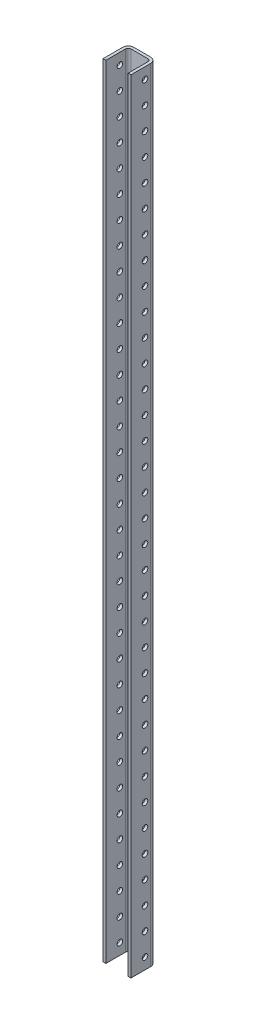
from build123d import *

# Parameters (mm, degrees)
EXTRUDE1_DEPTH = 444.5
SKETCH2_R      = 4.826
SKETCH2_R_2    = 1.5875
EXTRUDE2_DEPTH = 25
SKETCH3_R      = 3.175
EXTRUDE3_DEPTH = 35


with BuildPart() as part:
    # Sketch1 → Extrude1 (new, symmetric)
    with BuildSketch(Plane(origin=(0, 0, 0), x_dir=(1, 0, 0), z_dir=(0, 1, 0))):
        with BuildLine():
            Line((-12.7, 0), (-12.7, 22.225))
            ThreePointArc((-12.7, 22.225), (-11.77006403, 24.47006403), (-9.525, 25.4))
            Line((-9.525, 25.4), (9.525, 25.4))
            ThreePointArc((9.525, 25.4), (11.77006403, 24.47006403), (12.7, 22.225))
            Line((12.7, 22.225), (12.7, 0))
            Line((12.7, 0), (15.875, 0))
            Line((15.875, 0), (15.875, 22.225))
            ThreePointArc((15.875, 22.225), (14.015128061, 26.715128061), (9.525, 28.575))
            Line((9.525, 28.575), (-9.525, 28.575))
            ThreePointArc((-9.525, 28.575), (-14.015128061, 26.715128061), (-15.875, 22.225))
            Line((-15.875, 22.225), (-15.875, 0))
            Line((-15.875, 0), (-12.7, 0))
        make_face()
    extrude(amount=EXTRUDE1_DEPTH, both=True)

    # Sketch2 → Extrude2 (cut)
    with BuildSketch(Plane(origin=(0, 0, -28.575), x_dir=(-1, 0, 0), z_dir=(0, 0, -1))):
        with Locations((-1.905, 361.95)):
            Circle(SKETCH2_R)
        with Locations((-1.905, 336.55)):
            Circle(SKETCH2_R)
        with Locations((-1.905, 107.95)):
            Circle(SKETCH2_R)
        with Locations((-1.905, 82.55)):
            Circle(SKETCH2_R)
        with Locations((1.905, 0)):
            Circle(SKETCH2_R)
        with Locations((-1.905, -361.95)):
            Circle(SKETCH2_R)
        with Locations((-1.905, -336.55)):
            Circle(SKETCH2_R)
        with Locations((-1.905, -82.55)):
            Circle(SKETCH2_R)
        with Locations((-1.905, -107.95)):
            Circle(SKETCH2_R)
        with Locations((0, -241.3)):
            Circle(SKETCH2_R_2)
    extrude(amount=-EXTRUDE2_DEPTH, mode=Mode.SUBTRACT)

    # Sketch3 → Extrude3 (cut)
    with BuildSketch(Plane(origin=(15.875, 0, 0), x_dir=(0, 0, -1), z_dir=(1, 0, 0))):
        with Locations((15.875, 431.8)):
            Circle(SKETCH3_R)
        with Locations((15.875, 406.4)):
            Circle(SKETCH3_R)
        with Locations((15.875, 381)):
            Circle(SKETCH3_R)
        with Locations((15.875, 355.6)):
            Circle(SKETCH3_R)
        with Locations((15.875, 330.2)):
            Circle(SKETCH3_R)
        with Locations((15.875, 304.8)):
            Circle(SKETCH3_R)
        with Locations((15.875, 279.4)):
            Circle(SKETCH3_R)
        with Locations((15.875, 254)):
            Circle(SKETCH3_R)
        with Locations((15.875, 228.6)):
            Circle(SKETCH3_R)
        with Locations((15.875, 203.2)):
            Circle(SKETCH3_R)
        with Locations((15.875, 177.8)):
            Circle(SKETCH3_R)
        with Locations((15.875, 152.4)):
            Circle(SKETCH3_R)
        with Locations((15.875, 127)):
            Circle(SKETCH3_R)
        with Locations((15.875, 101.6)):
            Circle(SKETCH3_R)
        with Locations((15.875, 76.2)):
            Circle(SKETCH3_R)
        with Locations((15.875, 50.8)):
            Circle(SKETCH3_R)
        with Locations((15.875, 25.4)):
            Circle(SKETCH3_R)
        with Locations((15.875, 0)):
            Circle(SKETCH3_R)
        with Locations((15.875, -25.4)):
            Circle(SKETCH3_R)
        with Locations((15.875, -50.8)):
            Circle(SKETCH3_R)
        with Locations((15.875, -76.2)):
            Circle(SKETCH3_R)
        with Locations((15.875, -101.6)):
            Circle(SKETCH3_R)
        with Locations((15.875, -127)):
            Circle(SKETCH3_R)
        with Locations((15.875, -152.4)):
            Circle(SKETCH3_R)
        with Locations((15.875, -177.8)):
            Circle(SKETCH3_R)
        with Locations((15.875, -203.2)):
            Circle(SKETCH3_R)
        with Locations((15.875, -228.6)):
            Circle(SKETCH3_R)
        with Locations((15.875, -254)):
            Circle(SKETCH3_R)
        with Locations((15.875, -279.4)):
            Circle(SKETCH3_R)
        with Locations((15.875, -304.8)):
            Circle(SKETCH3_R)
        with Locations((15.875, -330.2)):
            Circle(SKETCH3_R)
        with Locations((15.875, -355.6)):
            Circle(SKETCH3_R)
        with Locations((15.875, -381)):
            Circle(SKETCH3_R)
        with Locations((15.875, -406.4)):
            Circle(SKETCH3_R)
        with Locations((15.875, -431.8)):
            Circle(SKETCH3_R)
    extrude(amount=-EXTRUDE3_DEPTH, mode=Mode.SUBTRACT)


solid = part.part
